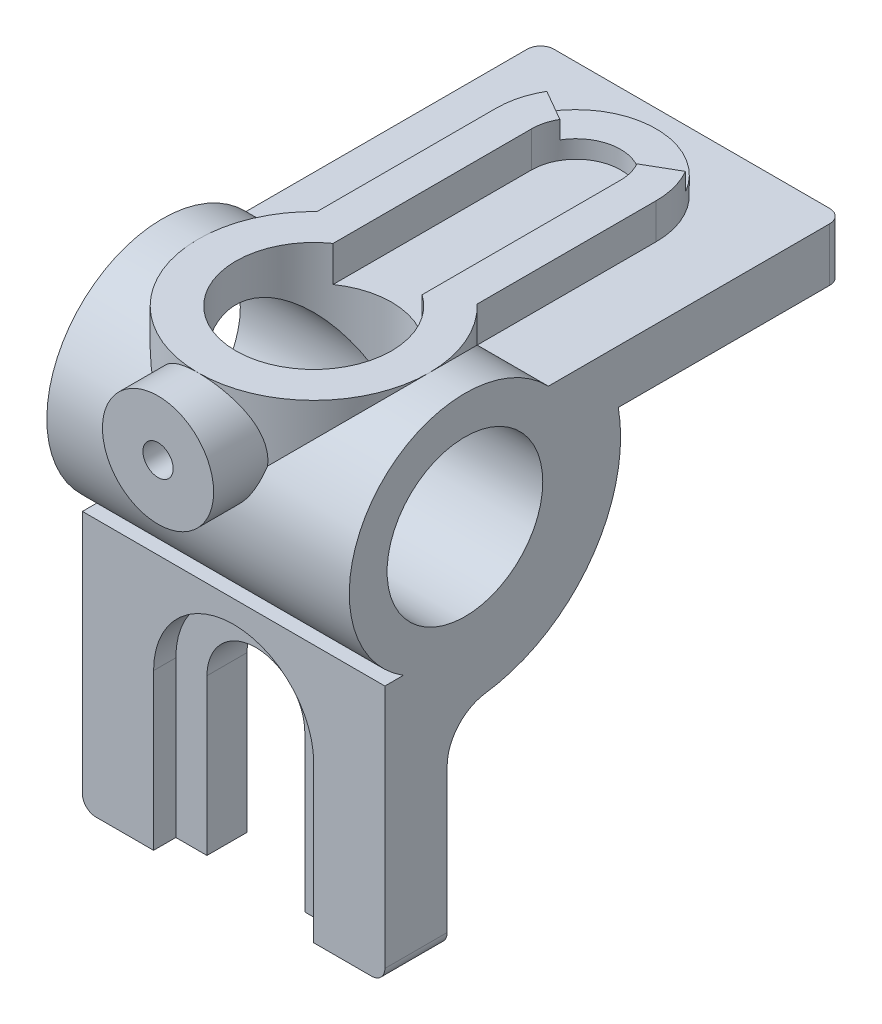
from build123d import *

# Parameters (mm, degrees)
EXTRUDE_6_DEPTH        = 34
EXTRUDE_7_REACH        = 108.193
EXTRUDE_7_END_RADIUS   = 26
SKETCH_15_R            = 12.5
EXTRUDE_8_REACH        = 150.176
EXTRUDE_8_END_RADIUS   = 26
SKETCH_16_W            = 68
SKETCH_16_H            = 12
EXTRUDE_9_DEPTH        = 8
FILLET_2_R             = 10
EXTRUDE_10_DEPTH       = 19
CUT_EXTRUDE_7_DEPTH    = 8
SKETCH_20_R            = 17.5
CUT_EXTRUDE_8_DEPTH    = 68
CUT_EXTRUDE_9_REACH    = 136.108
SKETCH_21_R            = 17.5
CUT_EXTRUDE_10_DEPTH   = 5
CUT_EXTRUDE_11_DEPTH   = 9
CUT_EXTRUDE_12_DEPTH   = 4
FILLET_3_R             = 3
HOLE_WIZARD_M8_1_D     = 6.8
HOLE_WIZARD_M8_1_DEPTH = 15.75
HOLE_WIZARD_M8_1_TIP   = 2.042926105


with BuildPart() as part:
    # 草图1 → 凸台-拉伸6 (new, symmetric)
    with BuildSketch(Plane(origin=(0, 0, 0), x_dir=(0, 0, -1), z_dir=(1, 0, 0))):
        with BuildLine():
            Line((-18, -22), (-13.856406461, -22))
            ThreePointArc((-13.856406461, -22), (9.116890708, 24.349174602), (-4, -25.690465157))
            Line((-4, -25.690465157), (-4, -80))
            Line((-4, -80), (-18, -80))
            Line((-18, -80), (-18, -22))
        make_face()
    extrude(amount=EXTRUDE_6_DEPTH, both=True)

    # 凸台-拉伸7: up to this cylinder (the profile starts outside it)
    extrude_7_end = Plane(origin=(0, 0, 0), z_dir=(-1, 0, 0)) * Cylinder(EXTRUDE_7_END_RADIUS, 269.386, mode=Mode.PRIVATE)
    # 草图15 → 凸台-拉伸7 (add, up to the surface)
    with BuildSketch(Plane.XY.offset(35), mode=Mode.PRIVATE) as extrude_7_sk1:
        with Locations((0, 13.5)):
            Circle(SKETCH_15_R)
    extrude_7_tool1 = extrude(extrude_7_sk1.sketch, amount=-EXTRUDE_7_REACH, mode=Mode.PRIVATE) - extrude_7_end
    add(extrude_7_tool1.solids().sort_by_distance((0, 13.5, 35))[0])

    # 凸台-拉伸8: up to this cylinder (the profile starts outside it)
    extrude_8_end = Plane(origin=(0, 0, 0), z_dir=(-1, 0, 0)) * Cylinder(EXTRUDE_8_END_RADIUS, 353.352, mode=Mode.PRIVATE)
    # 草图16 → 凸台-拉伸8 (add, up to the surface)
    with BuildSketch(Plane.XY.offset(-85), mode=Mode.PRIVATE) as extrude_8_sk1:
        with Locations((0, 12)):
            Rectangle(SKETCH_16_W, SKETCH_16_H)
    extrude_8_tool1 = extrude(extrude_8_sk1.sketch, amount=EXTRUDE_8_REACH, mode=Mode.PRIVATE) - extrude_8_end
    add(extrude_8_tool1.solids().sort_by_distance((0, 12, -85))[0])

    # 草图17 → 凸台-拉伸9 (add)
    with BuildSketch(Plane(origin=(34, 0, 0), x_dir=(0, 0, -1), z_dir=(1, 0, 0))):
        with BuildLine():
            Line((-4, -34.770677301), (-4, -25.690465157))
            ThreePointArc((-4, -25.690465157), (19.091227119, -17.650072155), (25.298221281, 6))
            Line((25.298221281, 6), (34.481879299, 6))
            ThreePointArc((34.481879299, 6), (25.452863755, -24.023982324), (-4, -34.770677301))
        make_face()
    extrude_9 = extrude(amount=-EXTRUDE_9_DEPTH)

    # 镜向2: 凸台-拉伸9 across plane
    add(extrude_9.mirror(Plane(origin=(0, 0, 0), x_dir=(0, 0, 1), z_dir=(1, 0, 0))))

    # 圆角2
    fillet_2_edges = [part.edges().sort_by_distance(p)[0] for p in [
        (30, -34.770677301, 4),
        (-30, -34.770677301, 4),
    ]]
    fillet(fillet_2_edges, radius=FILLET_2_R)

    # 草图18 → 凸台-拉伸10 (add)
    with BuildSketch(Plane(origin=(0, 26, 0), x_dir=(1, 0, 0), z_dir=(0, 1, 0))):
        with BuildLine():
            Line((-18, 59), (-18, 18.761663039))
            ThreePointArc((-18, 18.761663039), (0, -26), (18, 18.761663039))
            Line((18, 18.761663039), (18, 59))
            ThreePointArc((18, 59), (0, 77), (-18, 59))
        make_face()
    extrude(amount=-EXTRUDE_10_DEPTH)

    # 草图19 → 切除-拉伸7 (cut)
    with BuildSketch(Plane(origin=(0, 26, 0), x_dir=(1, 0, 0), z_dir=(0, 1, 0))):
        with BuildLine():
            Line((-10, 59), (-10, 14.361406616))
            ThreePointArc((-10, 14.361406616), (0, -17.5), (10, 14.361406616))
            Line((10, 14.361406616), (10, 59))
            ThreePointArc((10, 59), (0, 69), (-10, 59))
        make_face()
    extrude(amount=-CUT_EXTRUDE_7_DEPTH, mode=Mode.SUBTRACT)

    # 草图20 → 切除-拉伸8 (cut)
    with BuildSketch(Plane(origin=(34, 0, 0), x_dir=(0, 0, -1), z_dir=(1, 0, 0))):
        Circle(SKETCH_20_R)
    extrude(amount=-CUT_EXTRUDE_8_DEPTH, mode=Mode.SUBTRACT)

    # 草图21 → 切除-拉伸9 (cut, up to next)
    with BuildSketch(Plane(origin=(0, 18, 0), x_dir=(1, 0, 0), z_dir=(0, 1, 0)), mode=Mode.PRIVATE) as cut_extrude_9_sk1:
        with Locations(Location((0, 0, 0), (0, 0, 270))):
            Circle(SKETCH_21_R)
    cut_extrude_9_tool1 = extrude(cut_extrude_9_sk1.sketch, amount=-CUT_EXTRUDE_9_REACH, mode=Mode.PRIVATE) & part.part
    add(cut_extrude_9_tool1.solids().sort_by_distance((0, 18, 0))[0], mode=Mode.SUBTRACT)

    # 草图22 → 切除-拉伸10 (cut)
    with BuildSketch(Plane.XY.offset(18)):
        with BuildLine():
            Line((-18, -45), (-18, -80))
            Line((-18, -80), (18, -80))
            Line((18, -80), (18, -45))
            ThreePointArc((18, -45), (0, -27), (-18, -45))
        make_face()
    extrude(amount=-CUT_EXTRUDE_10_DEPTH, mode=Mode.SUBTRACT)

    # 草图23 → 切除-拉伸11 (cut)
    with BuildSketch(Plane.XY.offset(13)):
        with BuildLine():
            Line((11, -80), (11, -45))
            ThreePointArc((11, -45), (0, -34), (-11, -45))
            Line((-11, -45), (-11, -80))
            Line((-11, -80), (11, -80))
        make_face()
    extrude(amount=-CUT_EXTRUDE_11_DEPTH, mode=Mode.SUBTRACT)

    # 草图24 → 切除-拉伸12 (cut)
    with BuildSketch(Plane(origin=(0, 26, 0), x_dir=(1, 0, 0), z_dir=(0, 1, 0))):
        with BuildLine():
            Line((0, 59), (-15.588457268, 68))
            ThreePointArc((-15.588457268, 68), (0, 77), (15.588457268, 68))
            Line((15.588457268, 68), (0, 59))
        make_face()
    extrude(amount=-CUT_EXTRUDE_12_DEPTH, mode=Mode.SUBTRACT)

    # 圆角3
    fillet_3_edges = [part.edges().sort_by_distance(p)[0] for p in [
        (34, 12, -85),
        (-34, 12, -85),
        (-34, -80, 11),
        (34, -80, 11),
    ]]
    fillet(fillet_3_edges, radius=FILLET_3_R)

    # M8 螺纹孔1
    with Locations(Plane(origin=(0, 13.5, 35), x_dir=(1, 0, 0), z_dir=(0, 0, 1))):
        with Locations((0, 0)):
            Hole(HOLE_WIZARD_M8_1_D / 2, depth=HOLE_WIZARD_M8_1_DEPTH)
            with Locations((0, 0, -(HOLE_WIZARD_M8_1_DEPTH + HOLE_WIZARD_M8_1_TIP / 2))):  # 118° drill point
                Cone(0, HOLE_WIZARD_M8_1_D / 2, HOLE_WIZARD_M8_1_TIP, mode=Mode.SUBTRACT)


solid = part.part
